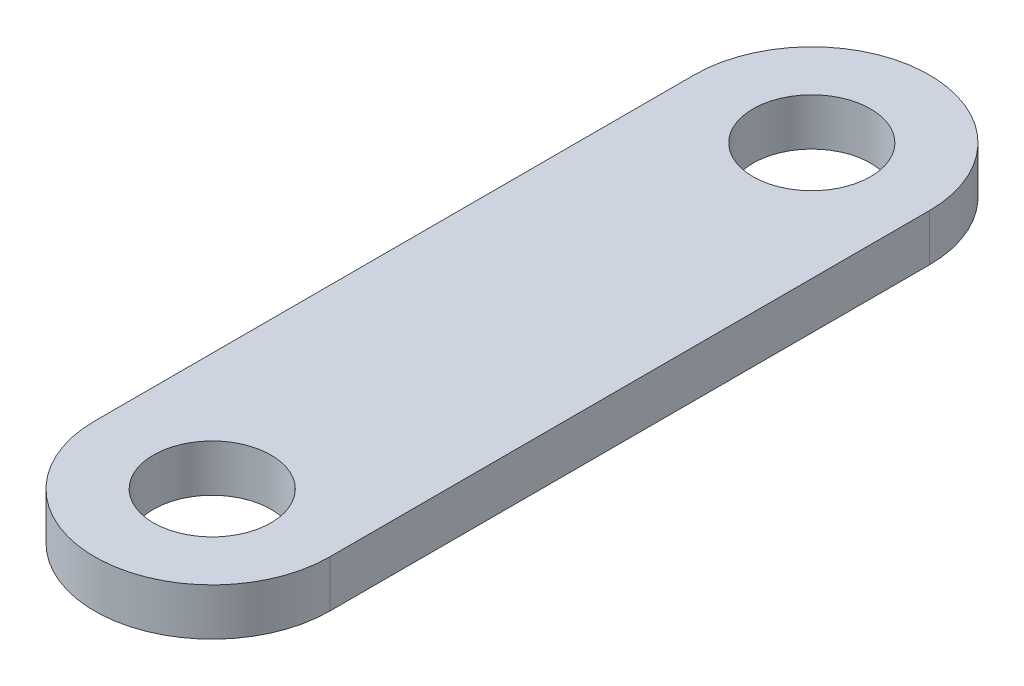
from build123d import *

# Parameters (mm, degrees)
SKETCH1_R           = 25
BOSS_EXTRUDE1_DEPTH = 20


with BuildPart() as part:
    # Sketch1 → Boss-Extrude1 (new body)
    with BuildSketch(Plane(origin=(0, 0, 0), x_dir=(1, 0, 0), z_dir=(0, 1, 0))):
        with BuildLine():
            Line((-50, 0), (-50, -255))
            ThreePointArc((-50, -255), (0, -305), (50, -255))
            Line((50, -255), (50, 0))
            ThreePointArc((50, 0), (0, 50), (-50, 0))
        make_face()
        with Locations(Location((0, 0, 0), (0, 0, 270))):
            Circle(SKETCH1_R, mode=Mode.SUBTRACT)
        with Locations(Location((0, -255, 0), (0, 0, 270))):
            Circle(SKETCH1_R, mode=Mode.SUBTRACT)
    extrude(amount=BOSS_EXTRUDE1_DEPTH)


solid = part.part
